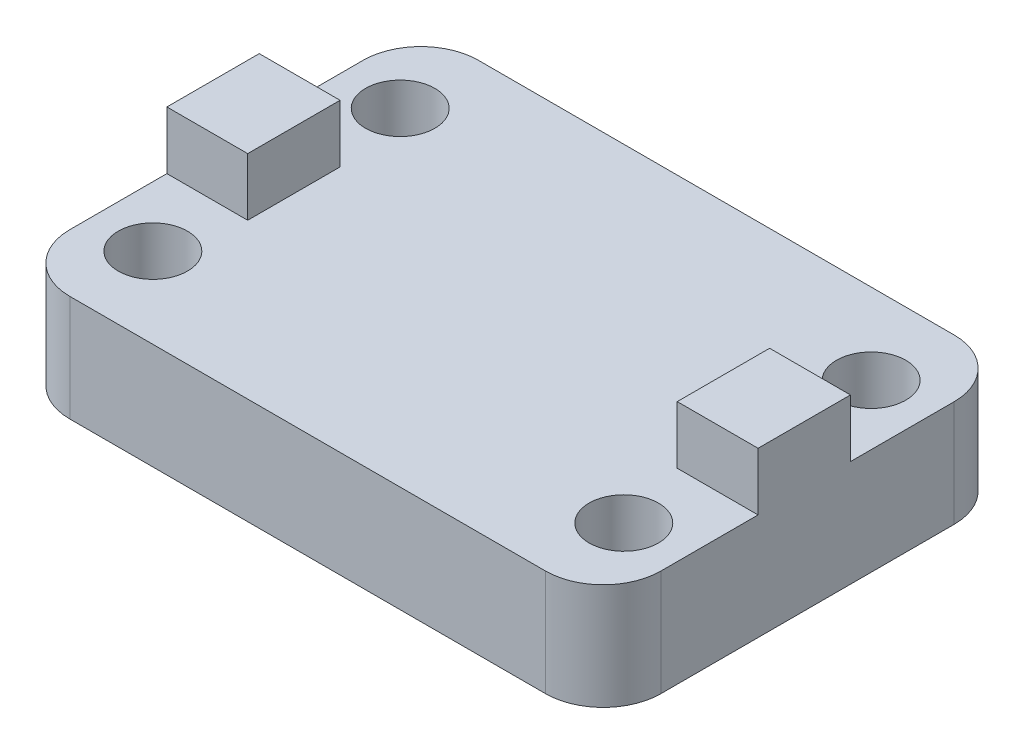
from build123d import *

# Parameters (mm, degrees)
SKETCH1_W               = 25.6
SKETCH1_H               = 17.7
BOSS_EXTRUDE1_DEPTH     = 4.6
FILLET1_R               = 2.5
SKETCH3_R               = 1.5
CUT_EXTRUDE1_DEPTH      = 32.461246002
MIRROR2_COPY_1_SKETCH_R = 1.5
MIRROR2_COPY_1_DEPTH    = 32.461246002
SKETCH6_W               = 3.5
SKETCH6_H               = 4
BOSS_EXTRUDE2_DEPTH     = 2.5


with BuildPart() as part:
    # Sketch1 → Boss-Extrude1 (new body)
    with BuildSketch(Plane(origin=(0, 0, 0), x_dir=(1, 0, 0), z_dir=(0, 1, 0))):
        with Locations((12.8, 8.85)):
            Rectangle(SKETCH1_W, SKETCH1_H)
    extrude(amount=BOSS_EXTRUDE1_DEPTH)

    # Fillet1
    fillet1_edges = [part.edges().sort_by_distance(p)[0] for p in [
        (0, 2.3, -17.7),
        (0, 2.3, 0),
        (25.6, 2.3, 0),
        (25.6, 2.3, -17.7),
    ]]
    fillet(fillet1_edges, radius=FILLET1_R)

    # Sketch3 → Cut-Extrude1 (cut, through all)
    with BuildSketch(Plane(origin=(0, 4.6, 0), x_dir=(1, 0, 0), z_dir=(0, 1, 0))):
        with Locations(Location((2.603725991, 3.494605911, 0), (0, 0, 270))):
            Circle(SKETCH3_R)
    cut_extrude1 = extrude(amount=-CUT_EXTRUDE1_DEPTH, mode=Mode.SUBTRACT)

    # Mirror1: Cut-Extrude1 across plane
    add(cut_extrude1.mirror(Plane.XY.offset(-8.85)), mode=Mode.SUBTRACT)

    # Mirror2: Cut-Extrude1 across plane
    add(cut_extrude1.mirror(Plane.ZY.offset(-12.8)), mode=Mode.SUBTRACT)

    # Mirror2 copy 1 sketch → Mirror2 copy 1 (cut, through all)
    with BuildSketch(Plane(origin=(25.6, 4.6, -17.7), x_dir=(-1, 0, 0), z_dir=(0, 1, 0))):
        with Locations(Location((2.603725991, 3.494605911, 0), (0, 0, 270))):
            Circle(MIRROR2_COPY_1_SKETCH_R)
    extrude(amount=-MIRROR2_COPY_1_DEPTH, mode=Mode.SUBTRACT)

    # Sketch6 → Boss-Extrude2 (add)
    with BuildSketch(Plane(origin=(0, 4.6, 0), x_dir=(1, 0, 0), z_dir=(0, 1, 0))):
        with Locations((1.75, 8.705394089)):
            Rectangle(SKETCH6_W, SKETCH6_H)
    boss_extrude2 = extrude(amount=BOSS_EXTRUDE2_DEPTH)

    # Mirror3: Boss-Extrude2 across plane
    add(boss_extrude2.mirror(Plane.ZY.offset(-12.8)))


solid = part.part
